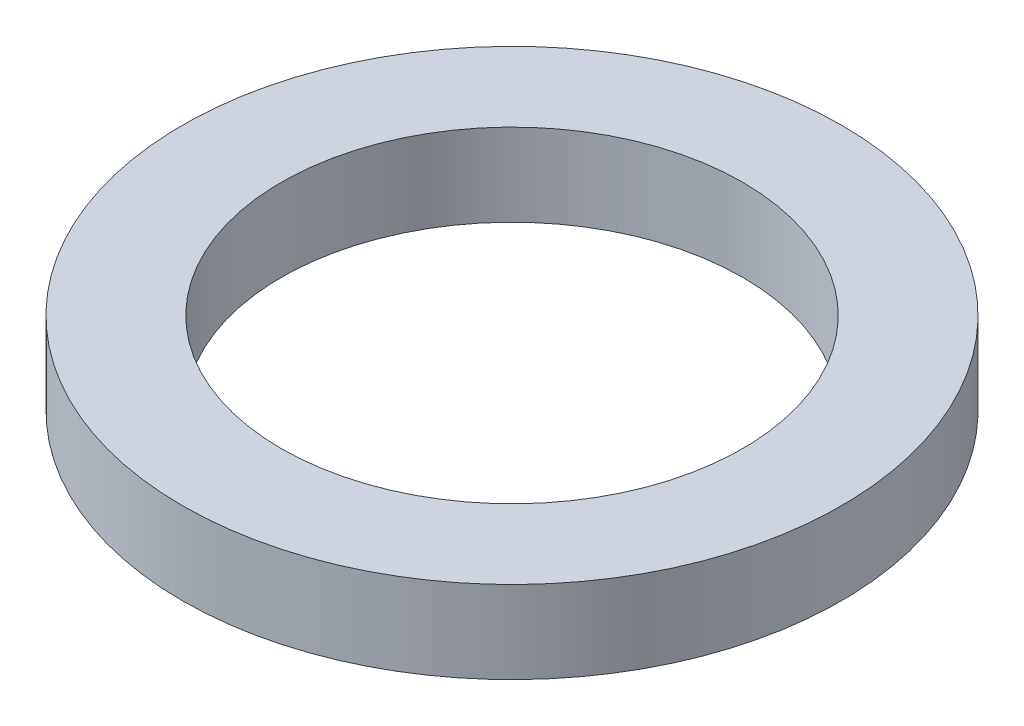
from build123d import *

# Parameters (mm, degrees)
SKETCH2_R           = 12.7
SKETCH2_R_2         = 8.89
BOSS_EXTRUDE1_DEPTH = 3.175


with BuildPart() as part:
    # Sketch2 → Boss-Extrude1 (new body)
    with BuildSketch(Plane(origin=(0, 0, 0), x_dir=(1, 0, 0), z_dir=(0, 1, 0))):
        with Locations(Location((0, 0, 0), (0, 0, 270))):
            Circle(SKETCH2_R)
        with Locations(Location((0, 0, 0), (0, 0, 270))):
            Circle(SKETCH2_R_2, mode=Mode.SUBTRACT)
    extrude(amount=BOSS_EXTRUDE1_DEPTH)


solid = part.part
